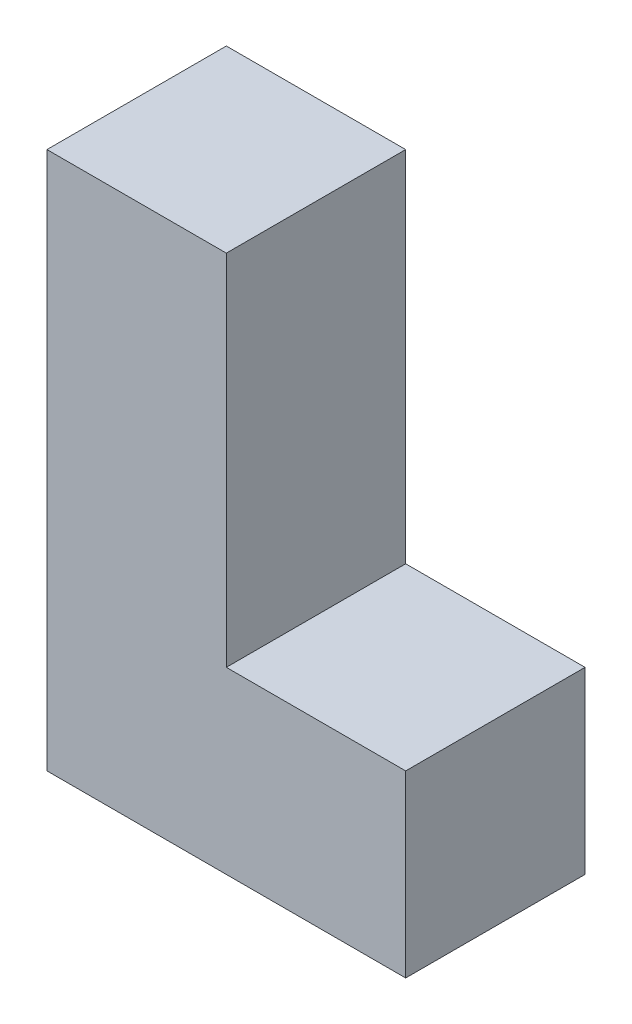
from build123d import *

# Parameters (mm, degrees)
BOSS_EXTRUDE1_DEPTH = 30


with BuildPart() as part:
    # Sketch1 → Boss-Extrude1 (new body)
    with BuildSketch(Plane.XY):
        Polygon((0, 0), (0, 90), (30, 90), (30, 30), (60, 30), (60, 0), align=None)
    extrude(amount=BOSS_EXTRUDE1_DEPTH)


solid = part.part
